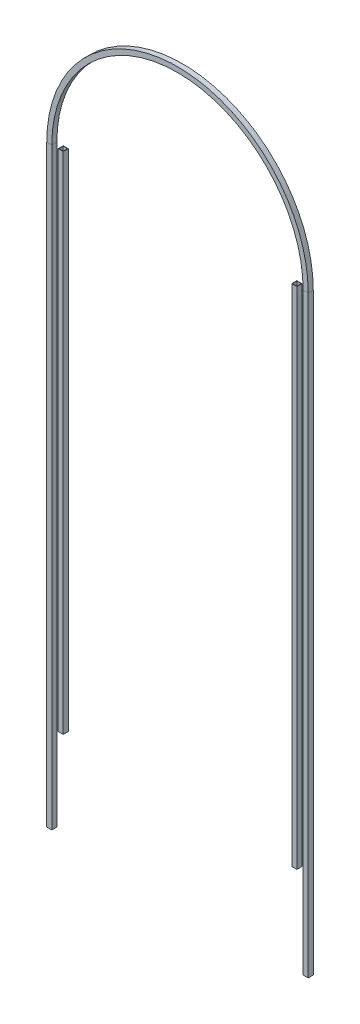
from build123d import *

# Parameters (mm, degrees)
SKETCH1_W    = 40
SKETCH1_H    = 40
SKETCH1_W_2  = 35
SKETCH1_H_2  = 35
SKETCH3_W    = 40
SKETCH3_H    = 40
SKETCH3_W_2  = 35
SKETCH3_H_2  = 35
SKETCH10_W   = 40
SKETCH10_H   = 40
SKETCH10_W_2 = 35
SKETCH10_H_2 = 35


with BuildPart() as part:
    # Sweep1: sweep along a path in Sketch2
    with BuildLine(Plane.XY) as sweep1_path:
        Line((0, 0), (0, 4700))
        ThreePointArc((0, 4700), (1015.820393, 5715.820393), (2031.640786, 4700))
        Line((2031.640786, 4700), (2031.640786, 0))
    # Sketch1 → Sweep1 (sweep)
    with BuildSketch(Plane(origin=(0, 0, 0), x_dir=(1, 0, 0), z_dir=(0, 1, 0))):
        Rectangle(SKETCH1_W, SKETCH1_H)
        Rectangle(SKETCH1_W_2, SKETCH1_H_2, mode=Mode.SUBTRACT)
    sweep(path=sweep1_path.line)


with BuildPart() as body_2:
    # Sweep2: sweep along a path in Sketch4
    with BuildLine(Plane.XY) as sweep2_path:
        Line((90, 4700), (90, 700))
    # Sketch3 → Sweep2 (sweep)
    with BuildSketch(Plane(origin=(0, 4700, 0), x_dir=(1, 0, 0), z_dir=(0, 1, 0))):
        with Locations((90, 0.555104089)):
            Rectangle(SKETCH3_W, SKETCH3_H)
        with Locations((90, 0.555104089)):
            Rectangle(SKETCH3_W_2, SKETCH3_H_2, mode=Mode.SUBTRACT)
    sweep(path=sweep2_path.line)


with BuildPart() as body_3:
    # Sweep4: sweep along a path in Sketch11
    with BuildLine(Plane.XY) as sweep4_path:
        Line((1941.640786, 4700), (1941.640786, 700))
    # Sketch10 → Sweep4 (sweep)
    with BuildSketch(Plane.XZ.offset(-4700)):
        with Locations((1941.640786, 0)):
            Rectangle(SKETCH10_W, SKETCH10_H)
        with Locations((1941.640786, 0)):
            Rectangle(SKETCH10_W_2, SKETCH10_H_2, mode=Mode.SUBTRACT)
    sweep(path=sweep4_path.line)


solid = Compound([part.part, body_2.part, body_3.part])
